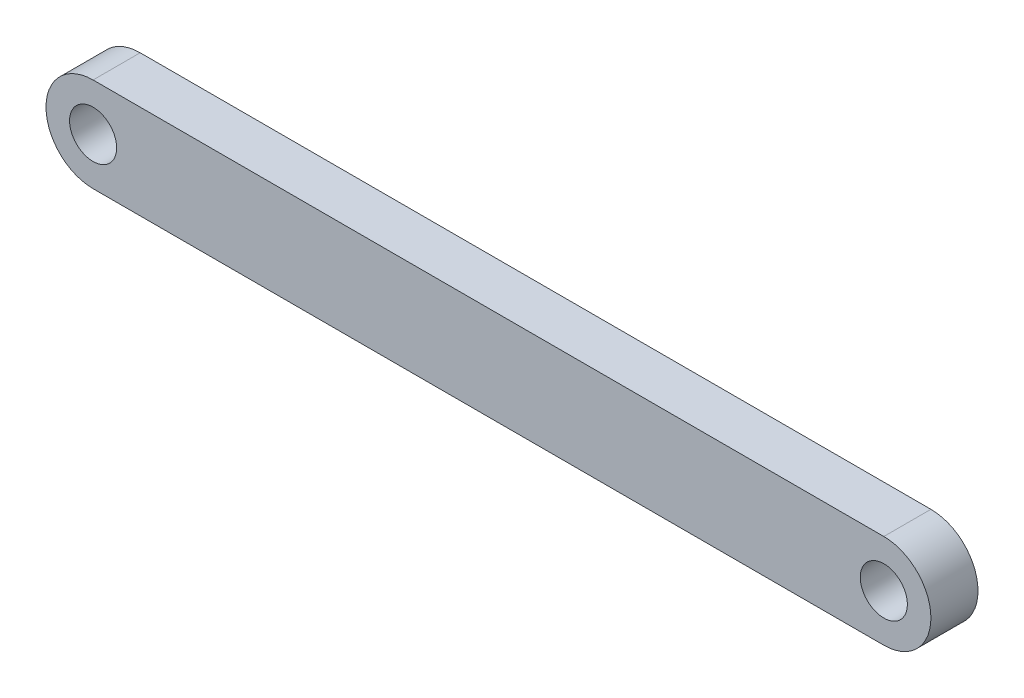
from build123d import *

# Parameters (mm, degrees)
ESBO_O1_R                = 2.5
RESSALTO_EXTRUS_O1_DEPTH = 5


with BuildPart() as part:
    # Esboço1 → Ressalto-extrusão1 (new body)
    with BuildSketch(Plane.XY):
        with BuildLine():
            Line((-41.98, 5), (41.98, 5))
            ThreePointArc((41.98, 5), (46.98, 0), (41.98, -5))
            Line((41.98, -5), (-41.98, -5))
            ThreePointArc((-41.98, -5), (-46.98, 0), (-41.98, 5))
        make_face()
        with Locations((-41.98, 0)):
            Circle(ESBO_O1_R, mode=Mode.SUBTRACT)
        with Locations((41.98, 0)):
            Circle(ESBO_O1_R, mode=Mode.SUBTRACT)
    extrude(amount=RESSALTO_EXTRUS_O1_DEPTH)


solid = part.part
